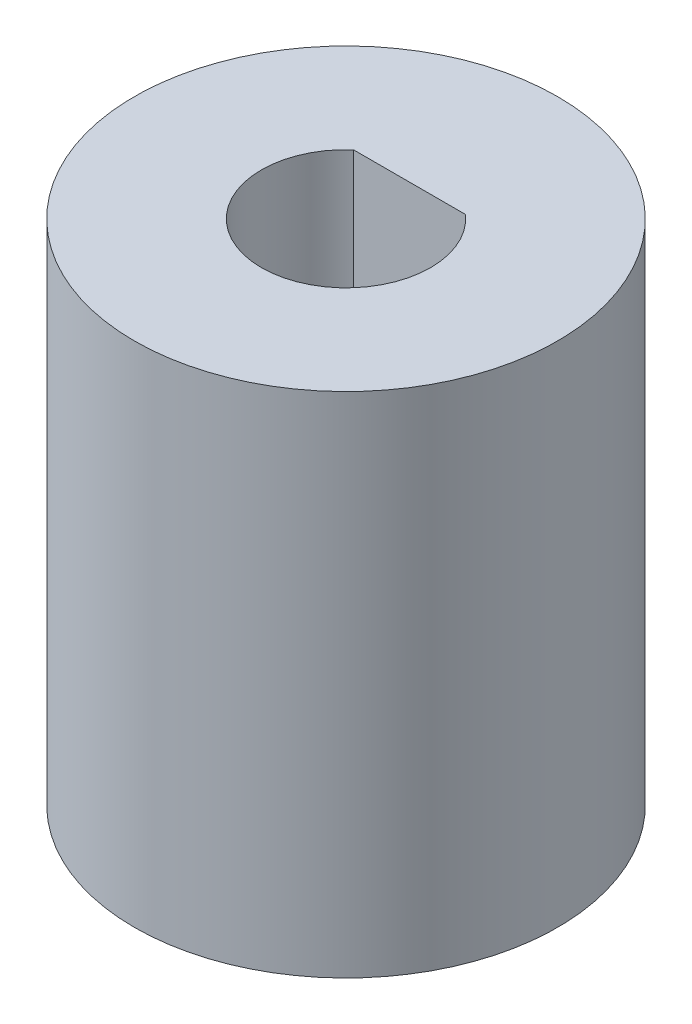
from build123d import *

# Parameters (mm, degrees)
SKETCH1_R      = 5
EXTRUDE1_DEPTH = 12
SKETCH2_R      = 1
EXTRUDE2_DEPTH = 12


with BuildPart() as part:
    # Sketch1 → Extrude1 (new body)
    with BuildSketch(Plane(origin=(0, 0, 0), x_dir=(1, 0, 0), z_dir=(0, 1, 0))):
        with Locations(Location((0, 0, 0), (0, 0, 270))):
            Circle(SKETCH1_R)
        with BuildLine():
            Line((-1.322875656, 1.5), (1.322875656, 1.5))
            ThreePointArc((1.322875656, 1.5), (0, -2), (-1.322875656, 1.5))
        make_face(mode=Mode.SUBTRACT)
    extrude(amount=EXTRUDE1_DEPTH)

    # Sketch2 → Extrude2 (cut)
    with BuildSketch(Plane.XY.offset(-1.5)):
        with Locations((0, 5.996836657)):
            Circle(SKETCH2_R)
    extrude(amount=-EXTRUDE2_DEPTH, mode=Mode.SUBTRACT)


solid = part.part
